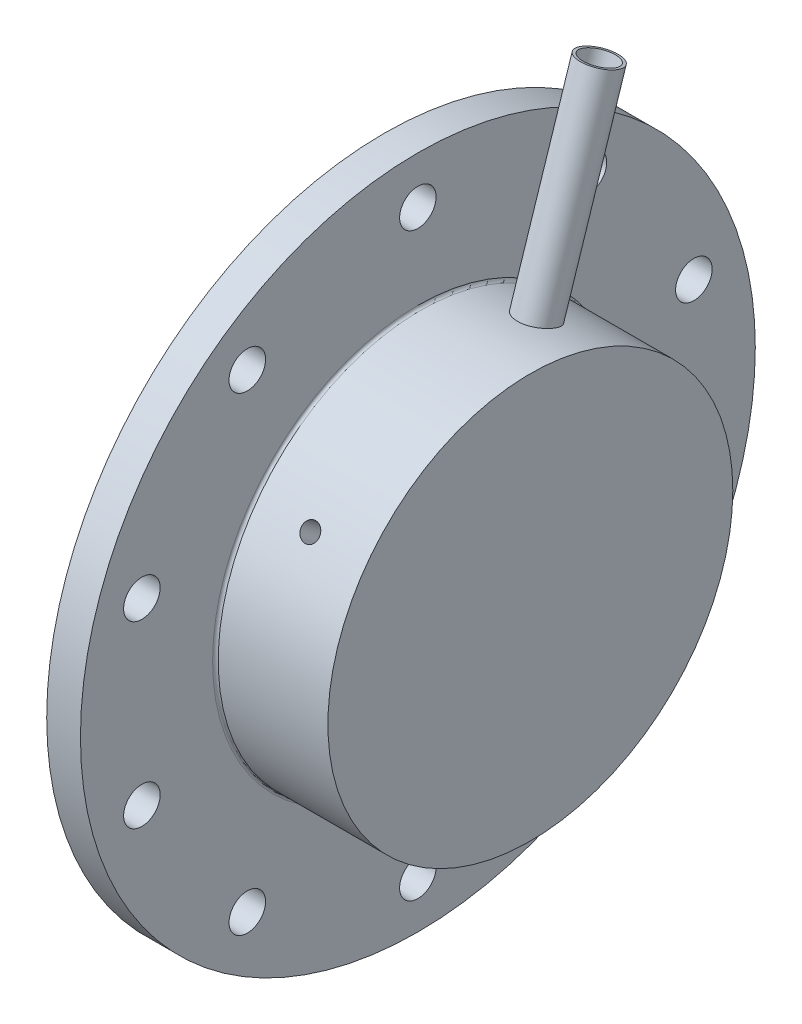
from build123d import *
from build123d.topology import SkipClean

# Parameters (mm, degrees)
SKETCH1_R                            = 60
SKETCH1_R_2                          = 31
SKETCH1_R_3                          = 3.25
BOSS_EXTRUDE1_DEPTH                  = 6
SKETCH8_R                            = 36
SKETCH8_R_2                          = 3
BOSS_EXTRUDE2_DEPTH                  = 20
FILLET1_R                            = 0.5
SKETCH29_R                           = 3
CUT_EXTRUDE1_DEPTH                   = 51
SKETCH32_R                           = 3.5
SKETCH32_R_2                         = 3
BOSS_EXTRUDE4_DEPTH                  = 36
BOSS_EXTRUDE4_DIRECTION_2_REACH      = 122.895
BOSS_EXTRUDE4_DIRECTION_2_END_RADIUS = 36
BOSS_EXTRUDE5_START                  = -7
SKETCH34_R                           = 3
BOSS_EXTRUDE5_DEPTH                  = 7


with BuildPart() as part:
    # Sketch1 → Boss-Extrude1 (new body)
    with BuildSketch(Plane(origin=(0, 0, 0), x_dir=(0, 0, -1), z_dir=(1, 0, 0))):
        Circle(SKETCH1_R)
        Circle(SKETCH1_R_2, mode=Mode.SUBTRACT)
        with Locations((0, 51.6)):
            Circle(SKETCH1_R_3, mode=Mode.SUBTRACT)
        with Locations((30.329719018, 41.74527691)):
            Circle(SKETCH1_R_3, mode=Mode.SUBTRACT)
        with Locations((49.074516241, 15.94527691)):
            Circle(SKETCH1_R_3, mode=Mode.SUBTRACT)
        with Locations((49.074516241, -15.94527691)):
            Circle(SKETCH1_R_3, mode=Mode.SUBTRACT)
        with Locations((30.329719018, -41.74527691)):
            Circle(SKETCH1_R_3, mode=Mode.SUBTRACT)
        with Locations((0, -51.6)):
            Circle(SKETCH1_R_3, mode=Mode.SUBTRACT)
        with Locations((-30.329719018, -41.74527691)):
            Circle(SKETCH1_R_3, mode=Mode.SUBTRACT)
        with Locations((-49.074516241, -15.94527691)):
            Circle(SKETCH1_R_3, mode=Mode.SUBTRACT)
        with Locations((-49.074516241, 15.94527691)):
            Circle(SKETCH1_R_3, mode=Mode.SUBTRACT)
        with Locations((-30.329719018, 41.74527691)):
            Circle(SKETCH1_R_3, mode=Mode.SUBTRACT)
    extrude(amount=BOSS_EXTRUDE1_DEPTH)

    # Sketch8 → Boss-Extrude2 (add)
    with BuildSketch(Plane(origin=(6, 0, 0), x_dir=(0, 0, -1), z_dir=(1, 0, 0))):
        Circle(SKETCH8_R)
        Circle(SKETCH8_R_2, mode=Mode.SUBTRACT)
    extrude(amount=BOSS_EXTRUDE2_DEPTH)

    # Sketch16 → Cut-Revolve4 (revolve, cut)
    with BuildSketch(Plane(origin=(16, 0, 0), x_dir=(0, 0, -1), z_dir=(1, 0, 0)), mode=Mode.PRIVATE) as cut_revolve4_sk:
        Polygon((44.335236369, 32.211434711), (43.394779965, 33.505861902), (0, 1.977708764), (0, 0), align=None)
    revolve(cut_revolve4_sk.sketch.rotate(Axis((16, 0, 0), (0, 0.5877852522924714, -0.8090169943749488)), 180), axis=Axis((16, 0, 0), (0, 0.5877852522924714, -0.8090169943749488)), mode=Mode.SUBTRACT)

    # Sketch28 → Cut-Revolve5 (revolve, cut)
    with BuildSketch(Plane(origin=(16, 0, -13), x_dir=(0, 0, 1), z_dir=(-1, 0, 0))):
        Polygon((48.826625906, 26.029567355), (47.886169502, 27.323994546), (13, 1.977708764), (13, 0), align=None)
    revolve(axis=Axis((16, -6.181867356, -8.508610463), (0, 0.5877852522924714, 0.8090169943749487)), mode=Mode.SUBTRACT)

    # Fillet1
    fillet1_edges = [part.edges().sort_by_distance(p)[0] for p in [
        (6, 0, 36),
    ]]
    fillet(fillet1_edges, radius=FILLET1_R)

    # Sketch29 → Cut-Extrude1 (cut)
    with BuildSketch(Plane(origin=(0, 0, 0), x_dir=(1, 0, 0), z_dir=(0, 0.9510565162951523, -0.3090169943749514))):
        with Locations(Location((16, 0, 0), (0, 0, 90))):
            Circle(SKETCH29_R)
    extrude(amount=CUT_EXTRUDE1_DEPTH, mode=Mode.SUBTRACT)

    # Sketch32 → Boss-Extrude4 (add)
    with BuildSketch(Plane(origin=(0, 34.238034587, -11.124611797), x_dir=(-1, 0, 0), z_dir=(0, 0.9510565162951523, -0.3090169943749514))):
        with Locations(Location((-16, 0, 0), (0, 0, 270))):
            Circle(SKETCH32_R)
        with Locations(Location((-16, 0, 0), (0, 0, 89.99999999))):
            Circle(SKETCH32_R_2, mode=Mode.SUBTRACT)
    extrude(amount=BOSS_EXTRUDE4_DEPTH)

    # Boss-Extrude4 direction 2: up to this cylinder (the profile starts outside it)
    with SkipClean():  # the faces are left unmerged after this step: merging them gives an invalid solid
        boss_extrude4_direction_2_end = Plane(origin=(16, 0, 0), z_dir=(-1, 0, 0)) * Cylinder(BOSS_EXTRUDE4_DIRECTION_2_END_RADIUS, 318.79, mode=Mode.PRIVATE)
        # Sketch32 → Boss-Extrude4 direction 2 (add, up to the surface)
        with BuildSketch(Plane(origin=(0, 34.238034587, -11.124611797), x_dir=(-1, 0, 0), z_dir=(0, 0.9510565162951523, -0.3090169943749514)), mode=Mode.PRIVATE) as boss_extrude4_direction_2_sk1:
            with Locations(Location((-16, 0, 0), (0, 0, 270))):
                Circle(SKETCH32_R)
            with Locations(Location((-16, 0, 0), (0, 0, 89.99999999))):
                Circle(SKETCH32_R_2, mode=Mode.SUBTRACT)
        boss_extrude4_direction_2_tool1 = extrude(boss_extrude4_direction_2_sk1.sketch, amount=-BOSS_EXTRUDE4_DIRECTION_2_REACH, mode=Mode.PRIVATE) - boss_extrude4_direction_2_end
        add(boss_extrude4_direction_2_tool1.solids().sort_by_distance((16, 35.289003, -7.890064))[0])
        add(boss_extrude4_direction_2_tool1.solids().sort_by_distance((16, 35.289003, -7.890064))[1])

    # Sketch33 → Cut-Revolve6 (revolve, cut)
    with BuildSketch(Plane.XY, mode=Mode.PRIVATE) as cut_revolve6_sk:
        with BuildLine():
            Line((0, 46.545), (2.17, 46.545))
            ThreePointArc((2.17, 46.545), (2.523553391, 46.398553391), (2.67, 46.045))
            Line((2.67, 46.045), (2.67, 42.445))
            ThreePointArc((2.67, 42.445), (2.523553391, 42.091446609), (2.17, 41.945))
            Line((2.17, 41.945), (0, 41.945))
            Line((0, 41.945), (0, 46.545))
        make_face()
        with BuildLine():
            Line((0, 40.195), (2.17, 40.195))
            ThreePointArc((2.17, 40.195), (2.523553391, 40.048553391), (2.67, 39.695))
            Line((2.67, 39.695), (2.67, 36.095))
            ThreePointArc((2.67, 36.095), (2.523553391, 35.741446609), (2.17, 35.595))
            Line((2.17, 35.595), (0, 35.595))
            Line((0, 35.595), (0, 40.195))
        make_face()
    revolve(cut_revolve6_sk.sketch.rotate(Axis((26, 0, 0), (-1, 0, 0)), 90), axis=Axis((26, 0, 0), (-1, 0, 0)), mode=Mode.SUBTRACT)

    # Sketch34 → Boss-Extrude5 (add)
    with BuildSketch(Plane(origin=(26, 0, 0), x_dir=(0, 0, -1), z_dir=(1, 0, 0)).offset(BOSS_EXTRUDE5_START)):
        with Locations(Location((0, 0, 0), (0, 0, 132.39851012))):
            Circle(SKETCH34_R)
    extrude(amount=BOSS_EXTRUDE5_DEPTH)


solid = part.part
